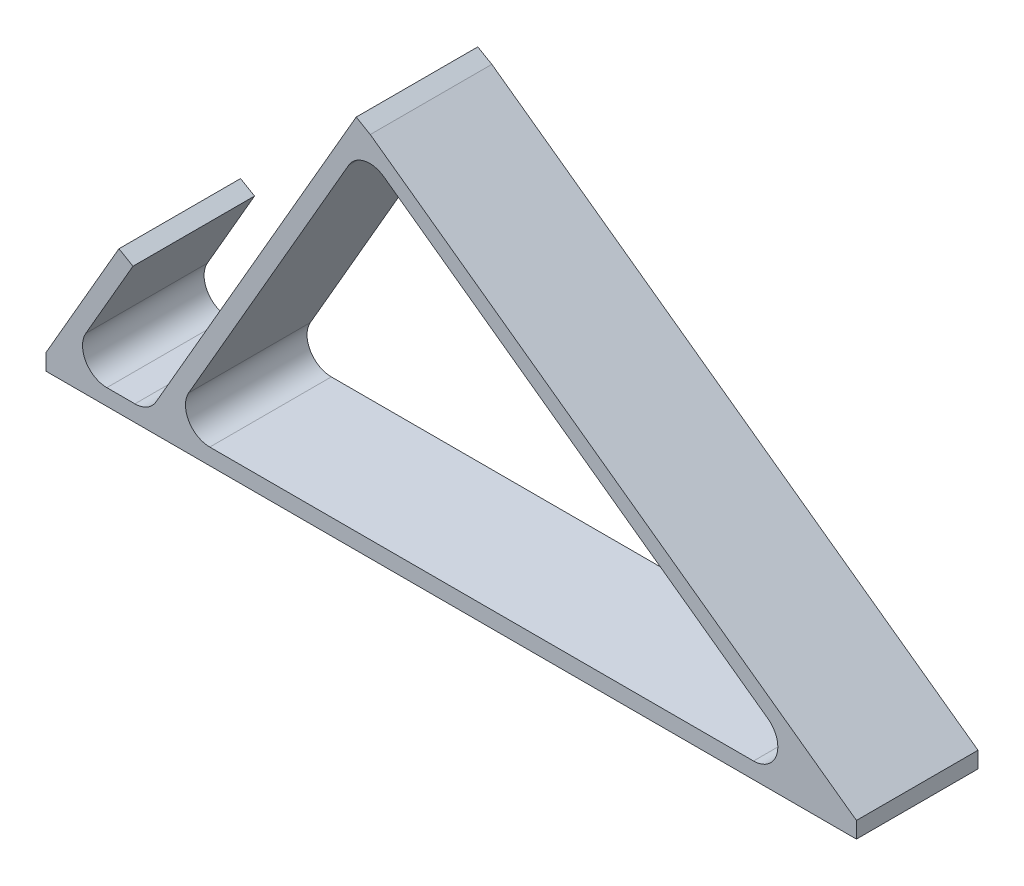
from build123d import *

# Parameters (mm, degrees)
BOSS_EXTRUDE1_DEPTH = 15


with BuildPart() as part:
    # Sketch1 → Boss-Extrude1 (new body)
    with BuildSketch(Plane.XY):
        with BuildLine():
            Line((0, 0), (100, 0))
            Line((100, 0), (100, 2))
            Line((100, 2), (40.011106999, 45.301270189))
            Line((40.011106999, 45.301270189), (38.279056191, 46.301270189))
            Line((38.279056191, 46.301270189), (13.567731326, 3.5))
            ThreePointArc((13.567731326, 3.5), (12.469655115, 2.401923789), (10.969655115, 2))
            Line((10.969655115, 2), (7.505553499, 2))
            ThreePointArc((7.505553499, 2), (4.907477288, 3.5), (4.907477288, 6.5))
            Line((4.907477288, 6.5), (10.732050808, 16.588457268))
            Line((10.732050808, 16.588457268), (9, 17.588457268))
            Line((9, 17.588457268), (0, 2))
            Line((0, 2), (0, 0))
        make_face()
        with BuildLine():
            Line((87.30088378, 2), (20.207259422, 2))
            ThreePointArc((20.207259422, 2), (17.60918321, 3.5), (17.60918321, 6.5))
            Line((17.60918321, 6.5), (37.345181053, 40.683751002))
            ThreePointArc((37.345181053, 40.683751002), (39.31497907, 42.117224457), (41.699088187, 41.616251315))
            Line((41.699088187, 41.616251315), (89.056714702, 7.432500313))
            ThreePointArc((89.056714702, 7.432500313), (90.15548541, 4.07736815), (87.30088378, 2))
        make_face(mode=Mode.SUBTRACT)
    extrude(amount=BOSS_EXTRUDE1_DEPTH)


solid = part.part
